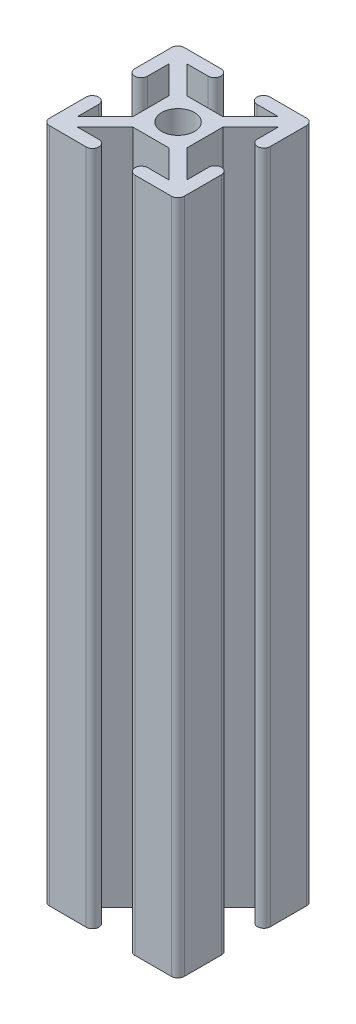
from build123d import *

# Parameters (mm, degrees)
CROQUIS2_R              = 3.645
SALIENTE_EXTRUIR1_DEPTH = 150


with BuildPart() as part:
    # Croquis2 → Saliente-Extruir1 (new body)
    with BuildSketch(Plane(origin=(0, 0, 0), x_dir=(1, 0, 0), z_dir=(0, 1, 0))):
        with BuildLine():
            Line((25.674146233, -8.213117031), (30.399146233, -8.213117031))
            Line((30.399146233, -8.213117031), (24.249146233, -2.063117031))
            Line((24.249146233, -2.063117031), (16.249146233, -2.063117031))
            Line((16.249146233, -2.063117031), (10.099146233, -8.213117031))
            Line((10.099146233, -8.213117031), (14.824146233, -8.213117031))
            ThreePointArc((14.824146233, -8.213117031), (16.249146233, -9.638117031), (14.824146233, -11.063117031))
            Line((14.824146233, -11.063117031), (6.64771046, -11.036681258))
            ThreePointArc((6.64771046, -11.036681258), (5.658776211, -10.62705128), (5.249146233, -9.638117031))
            Line((5.249146233, -9.638117031), (5.249146233, -1.488117031))
            ThreePointArc((5.249146233, -1.488117031), (6.64771046, -0.089552803), (8.046274687, -1.488117031))
            Line((8.046274687, -1.488117031), (8.046274687, -6.213117031))
            Line((8.046274687, -6.213117031), (14.196274687, -0.063117031))
            Line((14.196274687, -0.063117031), (14.196274687, 7.936882969))
            Line((14.196274687, 7.936882969), (8.046274687, 14.086882969))
            Line((8.046274687, 14.086882969), (8.046274687, 9.361882969))
            ThreePointArc((8.046274687, 9.361882969), (6.621274687, 7.936882969), (5.196274687, 9.361882969))
            Line((5.196274687, 9.361882969), (5.196274687, 17.511836379))
            ThreePointArc((5.196274687, 17.511836379), (5.613647524, 18.519463543), (6.621274687, 18.936836379))
            Line((6.621274687, 18.936836379), (14.771274687, 18.936836379))
            ThreePointArc((14.771274687, 18.936836379), (16.196274687, 17.511836379), (14.771274687, 16.086836379))
            Line((14.771274687, 16.086836379), (10.046274687, 16.086836379))
            Line((10.046274687, 16.086836379), (16.196274687, 9.936836379))
            Line((16.196274687, 9.936836379), (24.196274687, 9.936836379))
            Line((24.196274687, 9.936836379), (30.346274687, 16.086836379))
            Line((30.346274687, 16.086836379), (25.621274687, 16.086836379))
            ThreePointArc((25.621274687, 16.086836379), (24.196274687, 17.511836379), (25.621274687, 18.936836379))
            Line((25.621274687, 18.936836379), (33.771274687, 18.936836379))
            ThreePointArc((33.771274687, 18.936836379), (34.77890185, 18.519463543), (35.196274687, 17.511836379))
            Line((35.196274687, 17.511836379), (35.196274687, 9.465580065))
            ThreePointArc((35.196274687, 9.465580065), (33.771274687, 8.040580065), (32.346274687, 9.465580065))
            Line((32.346274687, 9.465580065), (32.346274687, 14.086836379))
            Line((32.346274687, 14.086836379), (26.196274687, 7.936836379))
            Line((26.196274687, 7.936836379), (26.196274687, -0.063163621))
            Line((26.196274687, -0.063163621), (32.346274687, -6.213163621))
            Line((32.346274687, -6.213163621), (32.346274687, -1.384419935))
            ThreePointArc((32.346274687, -1.384419935), (33.771274687, 0.040580065), (35.196274687, -1.384419935))
            Line((35.196274687, -1.384419935), (35.196274687, -9.638117031))
            ThreePointArc((35.196274687, -9.638117031), (34.77890185, -10.645744194), (33.771274687, -11.063117031))
            Line((33.771274687, -11.063117031), (25.674146233, -11.063117031))
            ThreePointArc((25.674146233, -11.063117031), (24.249146233, -9.638117031), (25.674146233, -8.213117031))
        make_face()
        with Locations(Location((20.249146233, 3.936882969, 0), (0, 0, 270))):
            Circle(CROQUIS2_R, mode=Mode.SUBTRACT)
    extrude(amount=SALIENTE_EXTRUIR1_DEPTH)


solid = part.part
